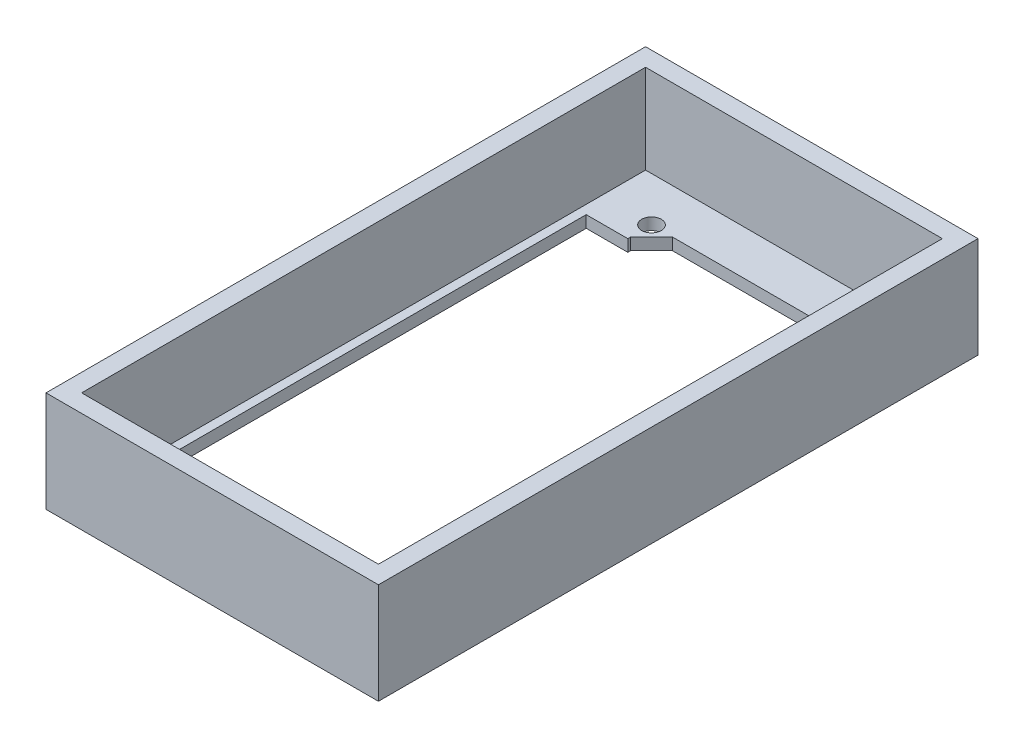
from build123d import *

# Parameters (mm, degrees)
SKETCH1_W           = 56
SKETCH1_H           = 101
SKETCH1_R           = 1.65
BOSS_EXTRUDE1_DEPTH = 2
SKETCH3_W           = 56
SKETCH3_H           = 101
SKETCH3_W_2         = 50
SKETCH3_H_2         = 95
BOSS_EXTRUDE2_DEPTH = 15
SKETCH5_W           = 7
SKETCH5_H           = 72
CUT_EXTRUDE2_DEPTH  = 60.659450215


with BuildPart() as part:
    # Sketch1 → Boss-Extrude1 (new body)
    with BuildSketch(Plane(origin=(0, 0, 0), x_dir=(1, 0, 0), z_dir=(0, 1, 0))):
        Rectangle(SKETCH1_W, SKETCH1_H)
        with Locations(Location((-16.5, 40, 0), (0, 0, 270))):
            Circle(SKETCH1_R, mode=Mode.SUBTRACT)
        with Locations(Location((16.5, 40, 0), (0, 0, 270))):
            Circle(SKETCH1_R, mode=Mode.SUBTRACT)
        with Locations(Location((-16.5, -40, 0), (0, 0, 270))):
            Circle(SKETCH1_R, mode=Mode.SUBTRACT)
        with Locations(Location((16.5, -40, 0), (0, 0, 270))):
            Circle(SKETCH1_R, mode=Mode.SUBTRACT)
        Polygon((-12.964466094, -40), (12.964466094, -40), (16.5, -36.464466094), (16.5, 36.464466094), (12.964466094, 40), (-12.964466094, 40), (-16.5, 36.464466094), (-16.5, -36.464466094), align=None, mode=Mode.SUBTRACT)
    extrude(amount=BOSS_EXTRUDE1_DEPTH)

    # Sketch3 → Boss-Extrude2 (add)
    with BuildSketch(Plane(origin=(0, 2, 0), x_dir=(1, 0, 0), z_dir=(0, 1, 0))):
        Rectangle(SKETCH3_W, SKETCH3_H)
        Rectangle(SKETCH3_W_2, SKETCH3_H_2, mode=Mode.SUBTRACT)
    extrude(amount=BOSS_EXTRUDE2_DEPTH)

    # Sketch5 → Cut-Extrude2 (cut, through all)
    with BuildSketch(Plane(origin=(0, 2, 0), x_dir=(1, 0, 0), z_dir=(0, 1, 0))):
        with Locations((-20, 0)):
            Rectangle(SKETCH5_W, SKETCH5_H)
    extrude(amount=-CUT_EXTRUDE2_DEPTH, mode=Mode.SUBTRACT)


solid = part.part
